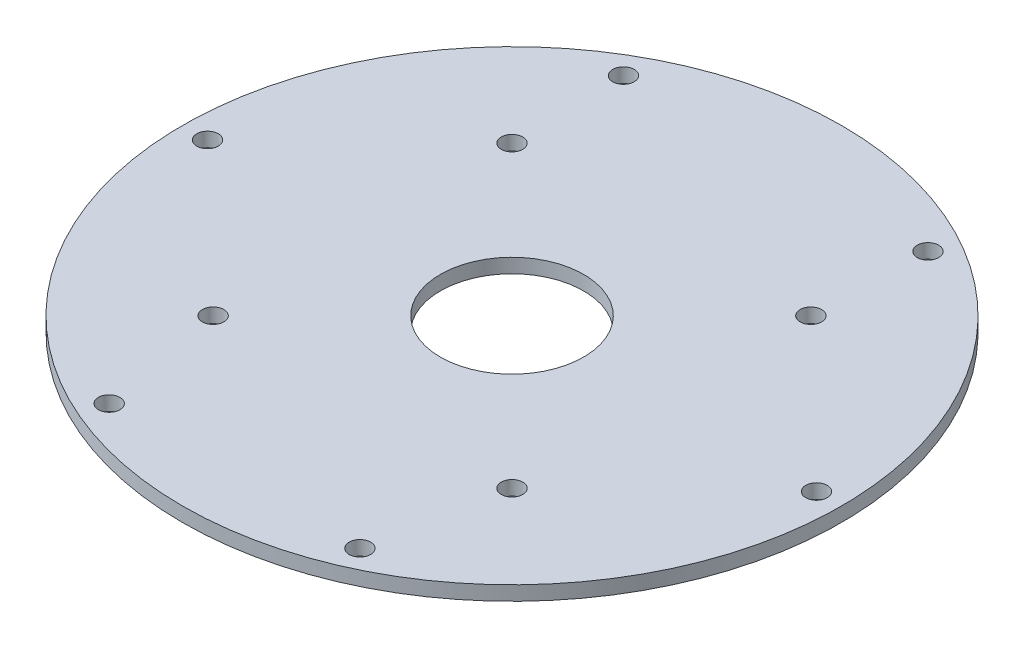
from build123d import *

# Parameters (mm, degrees)
SKETCH_1_R          = 46
EXTRUDE_1_DEPTH     = 2
SKETCH_2_R          = 1.5
CUT_EXTRUDE_1_DEPTH = 66.084560381
SKETCH_3_R          = 1.5
CUT_EXTRUDE_2_DEPTH = 66.084560381
SKETCH_4_R          = 10
CUT_EXTRUDE_3_DEPTH = 66.084560381


with BuildPart() as part:
    # 草图1 → 凸台-拉伸1 (new body)
    with BuildSketch(Plane(origin=(0, 0, 0), x_dir=(1, 0, 0), z_dir=(0, 1, 0))):
        with Locations(Location((0, 0, 0), (0, 0, 270))):
            Circle(SKETCH_1_R)
    extrude(amount=EXTRUDE_1_DEPTH)

    # 草图2 → 切除-拉伸1 (cut, through all)
    with BuildSketch(Plane(origin=(0, 2, 0), x_dir=(1, 0, 0), z_dir=(0, 1, 0))):
        with Locations(Location((-21.25, 36.806079661, 0), (0, 0, 270))):
            Circle(SKETCH_2_R)
        with Locations(Location((21.25, 36.806079661, 0), (0, 0, 270))):
            Circle(SKETCH_2_R)
        with Locations(Location((42.5, 0, 0), (0, 0, 270))):
            Circle(SKETCH_2_R)
        with Locations(Location((-42.5, 0, 0), (0, 0, 270))):
            Circle(SKETCH_2_R)
        with Locations(Location((-17.5, -38.729833462, 0), (0, 0, 270))):
            Circle(SKETCH_2_R)
        with Locations(Location((17.5, -38.729833462, 0), (0, 0, 90))):
            Circle(SKETCH_2_R)
    extrude(amount=-CUT_EXTRUDE_1_DEPTH, mode=Mode.SUBTRACT)

    # 草图3 → 切除-拉伸2 (cut, through all)
    with BuildSketch(Plane(origin=(0, 2, 0), x_dir=(1, 0, 0), z_dir=(0, 1, 0))):
        with Locations(Location((-20.859650045, -20.859650045, 0), (0, 0, 270))):
            Circle(SKETCH_3_R)
        with Locations(Location((-20.859650045, 20.859650045, 0), (0, 0, 270))):
            Circle(SKETCH_3_R)
        with Locations(Location((20.859650045, 20.859650045, 0), (0, 0, 270))):
            Circle(SKETCH_3_R)
        with Locations(Location((20.859650045, -20.859650045, 0), (0, 0, 270))):
            Circle(SKETCH_3_R)
    extrude(amount=-CUT_EXTRUDE_2_DEPTH, mode=Mode.SUBTRACT)

    # 草图4 → 切除-拉伸3 (cut, through all)
    with BuildSketch(Plane(origin=(0, 2, 0), x_dir=(1, 0, 0), z_dir=(0, 1, 0))):
        with Locations(Location((0, 0, 0), (0, 0, 270))):
            Circle(SKETCH_4_R)
    extrude(amount=-CUT_EXTRUDE_3_DEPTH, mode=Mode.SUBTRACT)


solid = part.part
